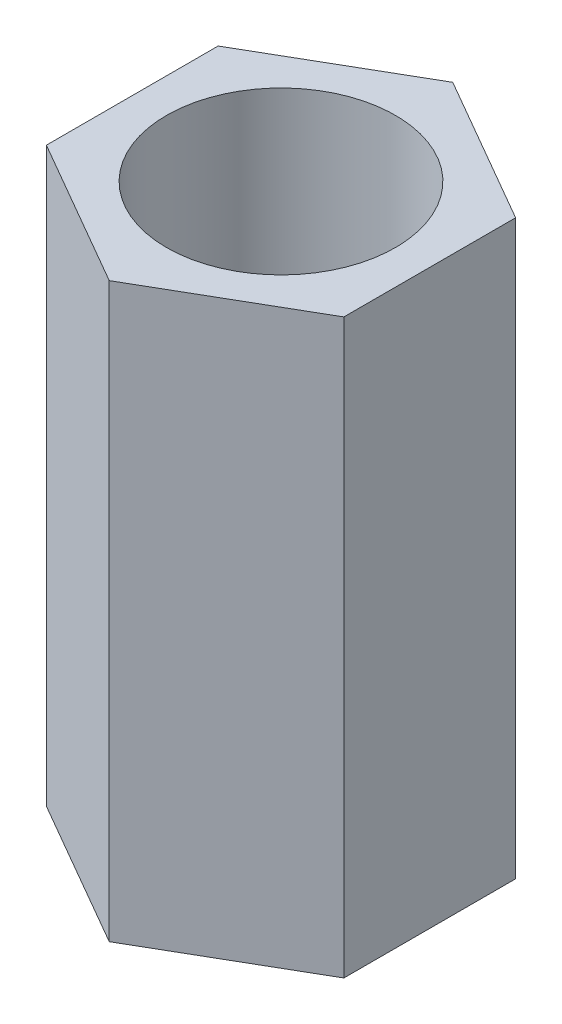
from build123d import *

# Parameters (mm, degrees)
SKETCH_1_R      = 2
EXTRUDE_1_DEPTH = 10


with BuildPart() as part:
    # 草图1 → 凸台-拉伸1 (new body)
    with BuildSketch(Plane(origin=(0, 0, 0), x_dir=(1, 0, 0), z_dir=(0, 1, 0))):
        Polygon((0, 3), (-2.598076211, 1.5), (-2.598076211, -1.5), (0, -3), (2.598076211, -1.5), (2.598076211, 1.5), align=None)
        with Locations(Location((0, 0, 0), (0, 0, 270))):
            Circle(SKETCH_1_R, mode=Mode.SUBTRACT)
    extrude(amount=EXTRUDE_1_DEPTH)


solid = part.part
